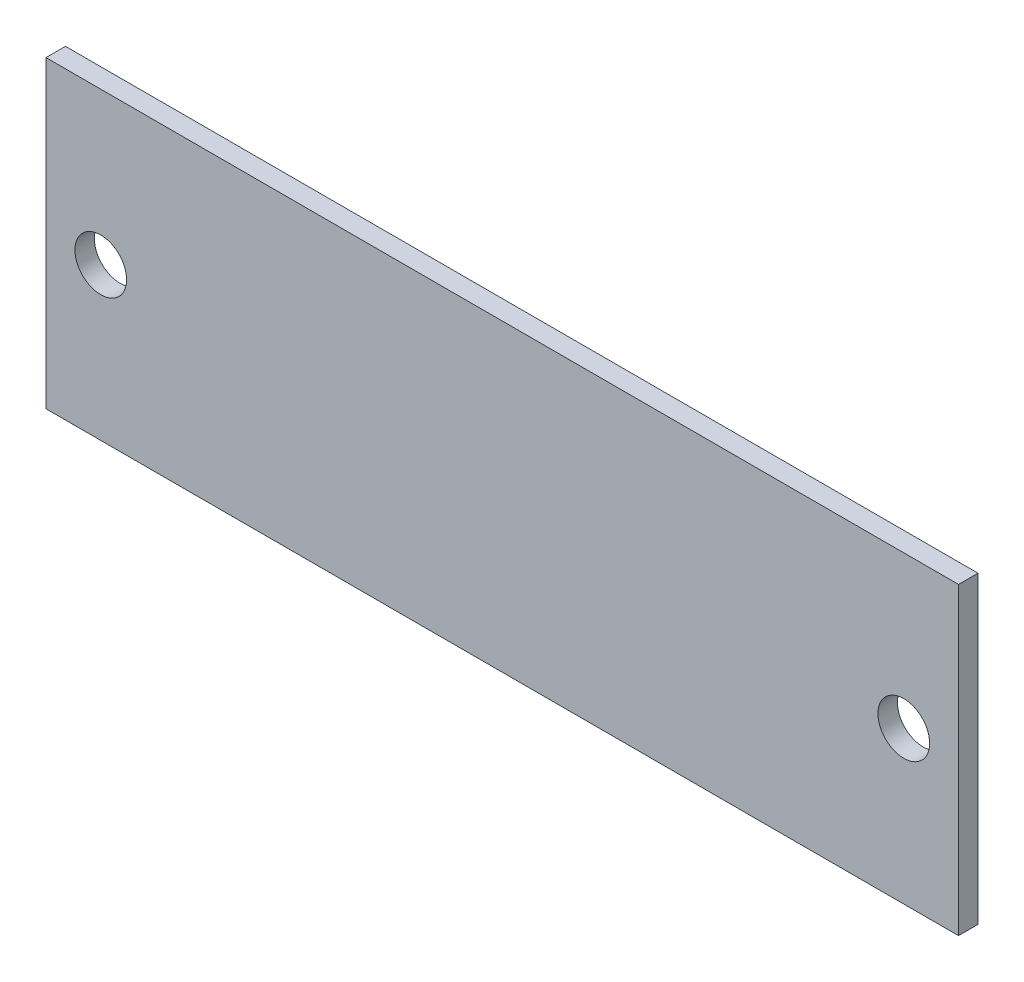
from build123d import *

# Parameters (mm, degrees)
SKETCH1_W           = 76.2
SKETCH1_H           = 25.4
BOSS_EXTRUDE1_DEPTH = 1.6256
SKETCH2_R           = 2.159
CUT_EXTRUDE1_DEPTH  = 41.19381265


with BuildPart() as part:
    # Sketch1 → Boss-Extrude1 (new body)
    with BuildSketch(Plane.XY):
        Rectangle(SKETCH1_W, SKETCH1_H)
    extrude(amount=-BOSS_EXTRUDE1_DEPTH)

    # Sketch2 → Cut-Extrude1 (cut, through all)
    with BuildSketch(Plane.XY):
        with Locations((33.528, 0)):
            Circle(SKETCH2_R)
        with Locations(Location((-33.528, 0, 0), (0, 0, 180))):
            Circle(SKETCH2_R)
    extrude(amount=-CUT_EXTRUDE1_DEPTH, mode=Mode.SUBTRACT)


solid = part.part
